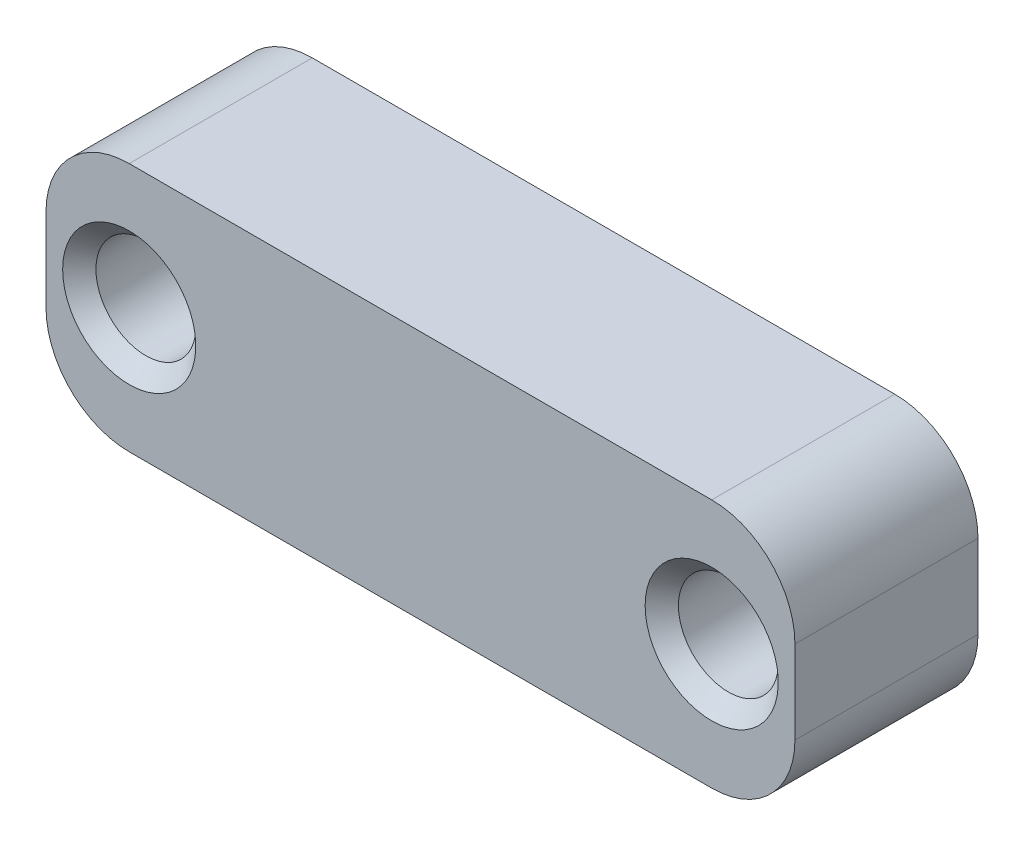
from build123d import *

# Parameters (mm, degrees)
CROQUIS1_W              = 45
CROQUIS1_H              = 15
CROQUIS1_R              = 3
SALIENTE_EXTRUIR1_DEPTH = 11
REDONDEO1_R             = 5
CHAFL_N1_SIZE           = 1


with BuildPart() as part:
    # Croquis1 → Saliente-Extruir1 (new body)
    with BuildSketch(Plane.XY):
        with Locations((22.5, 7.5)):
            Rectangle(CROQUIS1_W, CROQUIS1_H)
        with Locations((5, 7.5)):
            Circle(CROQUIS1_R, mode=Mode.SUBTRACT)
        with Locations((40, 7.5)):
            Circle(CROQUIS1_R, mode=Mode.SUBTRACT)
    extrude(amount=SALIENTE_EXTRUIR1_DEPTH)

    # Redondeo1
    redondeo1_edges = [part.edges().sort_by_distance(p)[0] for p in [
        (0, 0, 5.5),
        (0, 15, 5.5),
        (45, 15, 5.5),
        (45, 0, 5.5),
    ]]
    fillet(redondeo1_edges, radius=REDONDEO1_R)

    # Chaflán1
    chafl_n1_edges = [part.edges().sort_by_distance(p)[0] for p in [
        (2, 7.5, 11),
        (37, 7.5, 11),
    ]]
    chamfer(chafl_n1_edges, length=CHAFL_N1_SIZE)


solid = part.part
